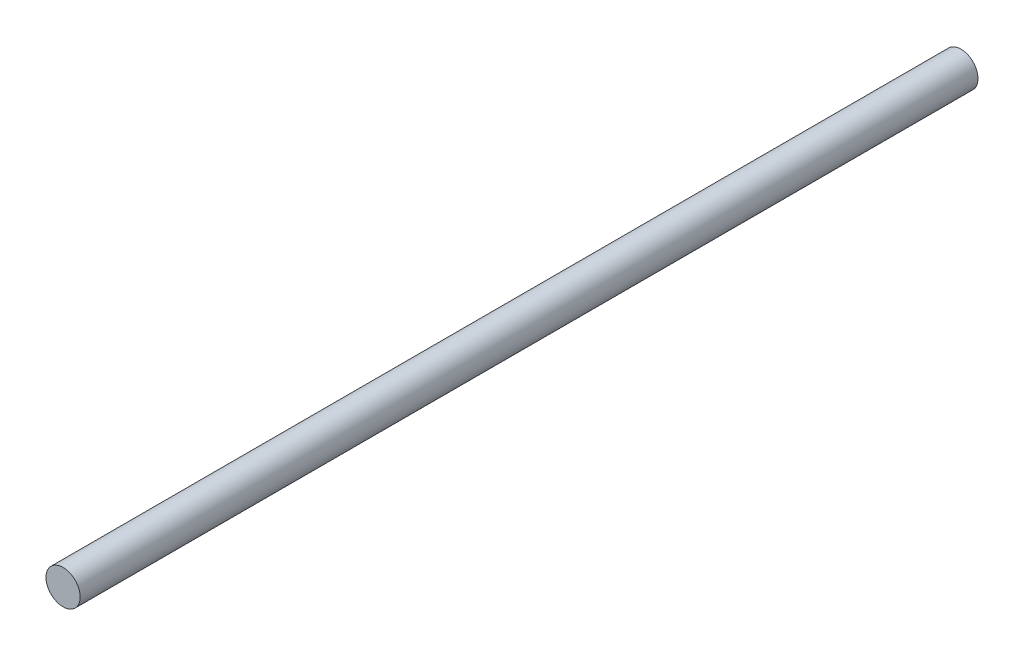
from build123d import *

# Parameters (mm, degrees)
SKETCH1_R           = 4
BOSS_EXTRUDE1_DEPTH = 210


with BuildPart() as part:
    # Sketch1 → Boss-Extrude1 (new body)
    with BuildSketch(Plane.XY):
        Circle(SKETCH1_R)
    extrude(amount=-BOSS_EXTRUDE1_DEPTH)


solid = part.part
